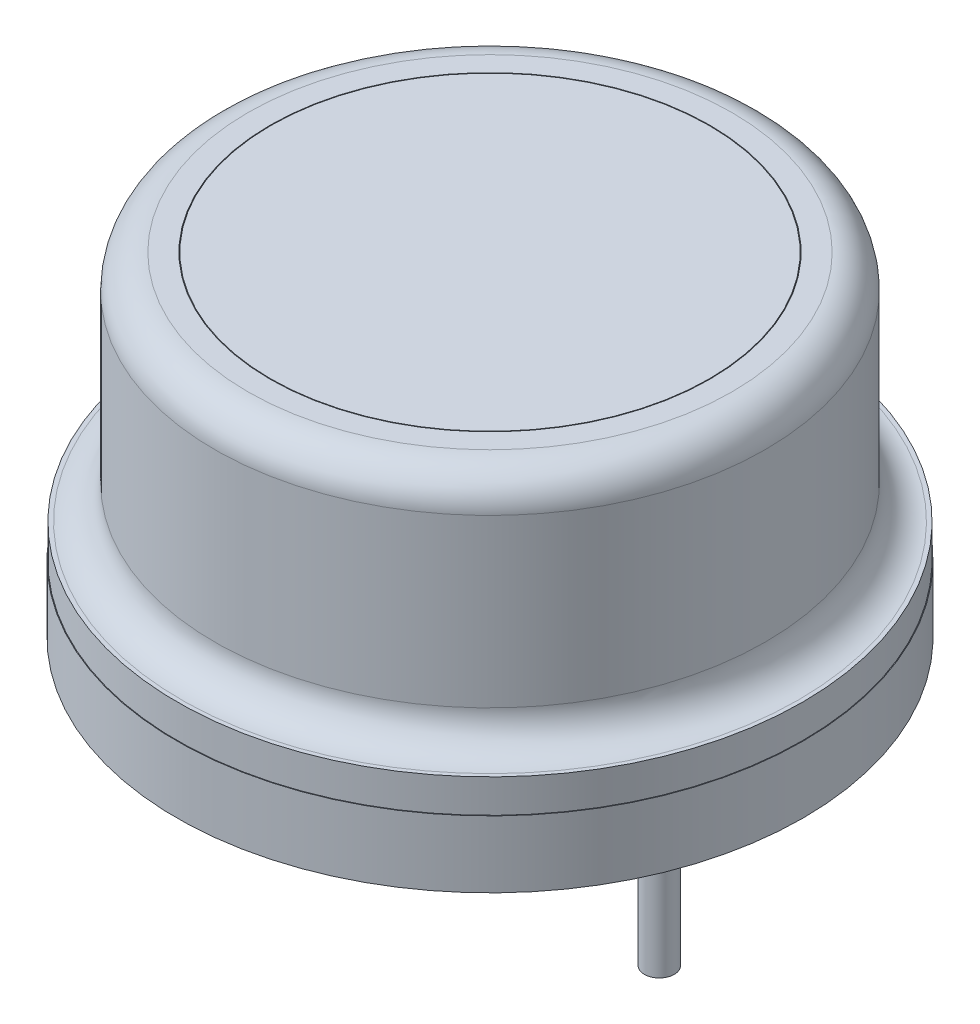
from build123d import *

# Parameters (mm, degrees)
SKETCH2_R             = 0.225
BOSS_EXTRUDE1_DEPTH   = 3
BOSS_EXTRUDE1_2_DEPTH = 3
SKETCH3_W             = 3.29
SKETCH3_H             = 0.59


with BuildPart() as part:
    # Sketch1 → Revolve1 (revolve)
    with BuildSketch(Plane.XY, mode=Mode.PRIVATE) as revolve1_sk:
        with BuildLine():
            Line((0, 4.4), (-3.3, 4.4))
            Line((-3.3, 4.4), (-3.3, 5))
            Line((-3.3, 5), (-3.63, 5))
            ThreePointArc((-3.63, 5), (-3.983553391, 4.853553391), (-4.13, 4.5))
            Line((-4.13, 4.5), (-4.13, 2))
            ThreePointArc((-4.13, 2), (-4.276446609, 1.646446609), (-4.63, 1.5))
            Line((-4.63, 1.5), (-4.69, 1.5))
            Line((-4.69, 1.5), (-4.69, 1))
            Line((-4.69, 1), (-4.7, 1))
            Line((-4.7, 1), (-4.7, 0))
            Line((-4.7, 0), (0, 0))
            Line((0, 0), (0, 4.4))
        make_face()
    revolve(revolve1_sk.sketch.rotate(Axis((0, 0, 0), (0, 1, 0)), 180), axis=Axis((0, 0, 0), (0, 1, 0)))


with BuildPart() as body_2:
    # Sketch2 → Boss-Extrude1 (new body)
    with BuildSketch(Plane.XZ):
        with Locations((-2.54, 0)):
            Circle(SKETCH2_R)
    extrude(amount=BOSS_EXTRUDE1_DEPTH)


with BuildPart() as body_3:
    # Sketch2 → Boss-Extrude1 2 (new body)
    with BuildSketch(Plane.XZ):
        with Locations((2.54, 0)):
            Circle(SKETCH2_R)
    extrude(amount=BOSS_EXTRUDE1_2_DEPTH)


with BuildPart() as body_4:
    # Sketch3 → Revolve2 (revolve)
    with BuildSketch(Plane.XY, mode=Mode.PRIVATE) as revolve2_sk:
        with Locations((-1.645, 4.705)):
            Rectangle(SKETCH3_W, SKETCH3_H)
    revolve(revolve2_sk.sketch.rotate(Axis((0, 4.41, 0), (0, 1, 0)), 270), axis=Axis((0, 4.41, 0), (0, 1, 0)))


solid = Compound([part.part, body_2.part, body_3.part, body_4.part])
